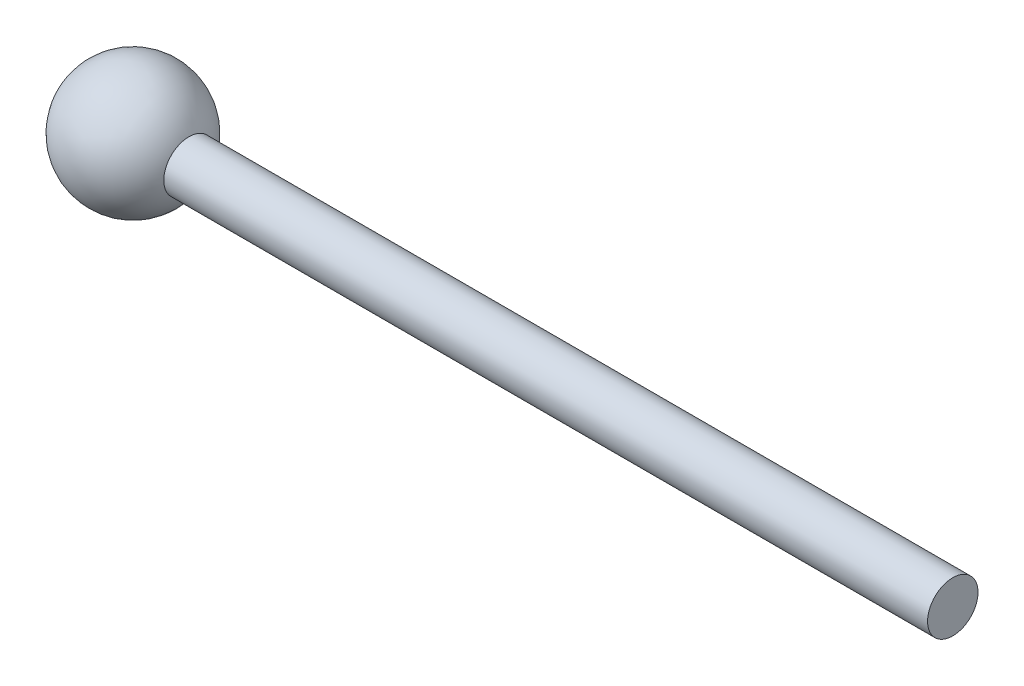
from build123d import *


with BuildPart() as part:
    # Sketch1 → Revolve1 (revolve)
    with BuildSketch(Plane.XY):
        with BuildLine():
            Line((198.514019246, 0), (198.514019246, -4))
            Line((198.514019246, -4), (77.405728868, -4))
            ThreePointArc((77.405728868, -4), (66.46849594, -9.533012871), (58.764019246, 0))
            Line((58.764019246, 0), (198.514019246, 0))
        make_face()
    revolve(axis=Axis((198.514019246, 0, 0), (-1, 0, 0)))


solid = part.part
